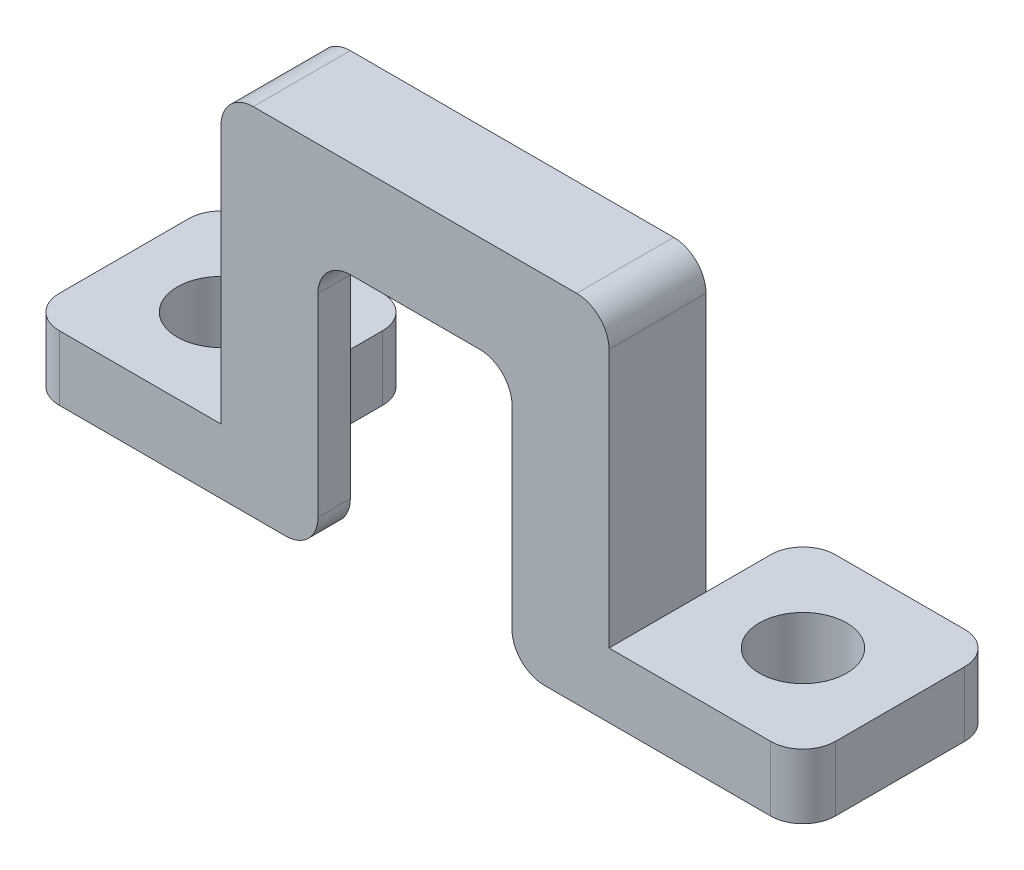
from build123d import *

# Parameters (mm, degrees)
BOSS_EXTRUDE1_DEPTH = 2.54
BOSS_EXTRUDE2_DEPTH = 5.08
SKETCH2_W           = 15.24
SKETCH2_H           = 15.24
SKETCH2_R           = 3.429
BOSS_EXTRUDE3_DEPTH = 5.08
FILLET1_R           = 2.54


with BuildPart() as part:
    # Sketch1 → Boss-Extrude1 (new body)
    with BuildSketch(Plane.XY):
        Polygon((-2.54, 27.94), (-2.54, 0), (5.08, 0), (5.08, 20.32), (20.32, 20.32), (20.32, 0), (27.94, 0), (27.94, 27.94), align=None)
    extrude(amount=BOSS_EXTRUDE1_DEPTH)

    # Sketch1<3> → Boss-Extrude2 (add)
    with BuildSketch(Plane.XY):
        Polygon((-2.54, 27.94), (-2.54, 0), (0, 0), (0, 25.4), (25.4, 25.4), (25.4, 0), (27.94, 0), (27.94, 27.94), align=None)
    extrude(amount=-BOSS_EXTRUDE2_DEPTH)

    # Sketch2 → Boss-Extrude3 (add)
    with BuildSketch(Plane.XZ):
        with Locations((35.56, -5.08)):
            Rectangle(SKETCH2_W, SKETCH2_H)
        with Locations((35.56, -5.08)):
            Circle(SKETCH2_R, mode=Mode.SUBTRACT)
    boss_extrude3 = extrude(amount=-BOSS_EXTRUDE3_DEPTH)

    # Mirror1: Boss-Extrude3 across plane
    add(boss_extrude3.mirror(Plane(origin=(12.7, 0, 0), x_dir=(0, 0, 1), z_dir=(1, 0, 0))))

    # Fillet1
    fillet1_edges = [part.edges().sort_by_distance(p)[0] for p in [
        (20.32, 20.32, 1.27),
        (5.08, 20.32, 1.27),
        (5.08, 0, 1.27),
        (20.32, 0, 1.27),
        (-2.54, 27.94, -1.27),
        (27.94, 27.94, -1.27),
        (27.94, 2.54, -12.7),
        (43.18, 2.54, -12.7),
        (43.18, 2.54, 2.54),
        (-2.54, 2.54, -12.7),
        (-17.78, 2.54, -12.7),
        (-17.78, 2.54, 2.54),
    ]]
    fillet(fillet1_edges, radius=FILLET1_R)


solid = part.part
